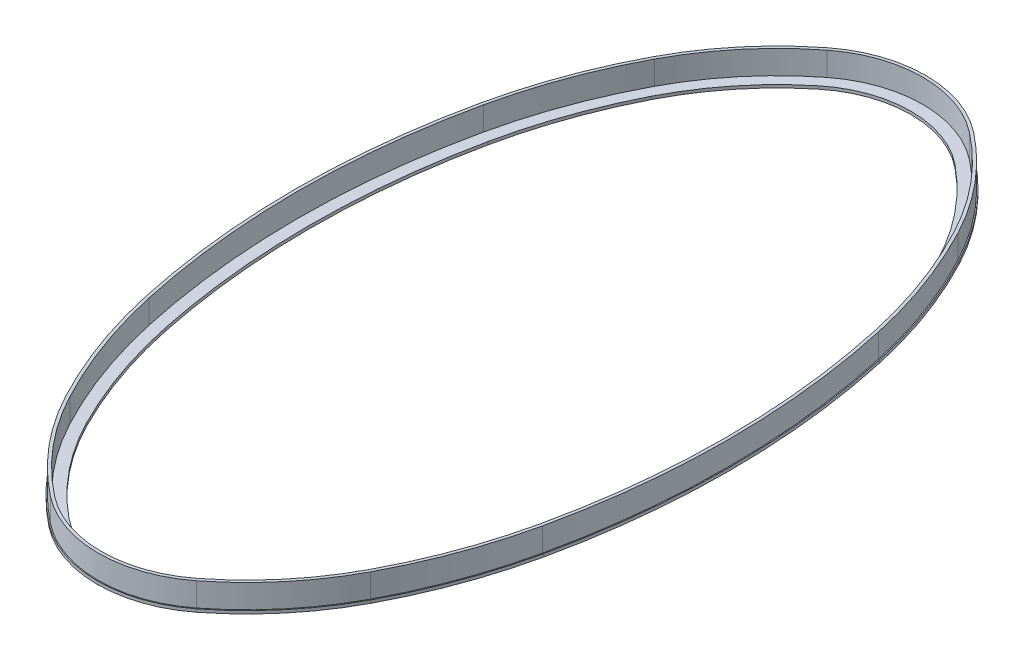
from build123d import *

# Parameters (mm, degrees)
AUFSATZ_LINEAR_AUSTRAGEN1_DEPTH = 3
AUFSATZ_LINEAR_AUSTRAGEN2_DEPTH = 24


with BuildPart() as part:
    # Skizze6 → Aufsatz-Linear austragen1 (new body)
    with BuildSketch(Plane(origin=(0, 0, 0), x_dir=(1, 0, 0), z_dir=(0, 1, 0))):
        with BuildLine():
            ThreePointArc((74.715017555, -984.244606231), (39.514788866, -1003.380457082), (0, -1010))
            ThreePointArc((0, -1010), (-39.514788866, -1003.380457082), (-74.715017555, -984.244606231))
            ThreePointArc((-74.715017555, -984.244606231), (-120.229343231, -940.206746616), (-155.564200335, -887.64882814))
            ThreePointArc((-155.564200335, -887.64882814), (-183.386784686, -825.20269993), (-202.517873317, -759.570264533))
            ThreePointArc((-202.517873317, -759.570264533), (-221.000459131, -589), (-202.517873317, -418.429735467))
            ThreePointArc((-202.517873317, -418.429735467), (-183.386784686, -352.79730007), (-155.564200335, -290.35117186))
            ThreePointArc((-155.564200335, -290.35117186), (-120.229343231, -237.793253384), (-74.715017555, -193.755393769))
            ThreePointArc((-74.715017555, -193.755393769), (0, -168), (74.715017555, -193.755393769))
            ThreePointArc((74.715017555, -193.755393769), (120.22934323, -237.793253384), (155.564200335, -290.35117186))
            ThreePointArc((155.564200335, -290.35117186), (183.386784686, -352.79730007), (202.517873317, -418.429735467))
            ThreePointArc((202.517873317, -418.429735467), (221.000459131, -589), (202.517873317, -759.570264533))
            ThreePointArc((202.517873317, -759.570264533), (183.386784686, -825.20269993), (155.564200335, -887.64882814))
            ThreePointArc((155.564200335, -887.64882814), (120.229343231, -940.206746616), (74.715017555, -984.244606231))
        make_face()
        with BuildLine():
            ThreePointArc((69.633932259, -969.139895548), (0, -994), (-69.633932259, -969.139895548))
            ThreePointArc((-69.633932259, -969.139895548), (-112.193543045, -926.193933206), (-144.95696967, -875.378246381))
            ThreePointArc((-144.95696967, -875.378246381), (-170.511926155, -815.453351782), (-188.023213714, -752.704617917))
            ThreePointArc((-188.023213714, -752.704617917), (-205.000112468, -589), (-188.023213714, -425.295382084))
            ThreePointArc((-188.023213714, -425.295382084), (-170.511926155, -362.546648219), (-144.95696967, -302.621753619))
            ThreePointArc((-144.95696967, -302.621753619), (-112.193543045, -251.806066794), (-69.633932259, -208.860104452))
            ThreePointArc((-69.633932259, -208.860104452), (0, -184), (69.633932259, -208.860104452))
            ThreePointArc((69.633932259, -208.860104452), (112.193543044, -251.806066794), (144.95696967, -302.621753619))
            ThreePointArc((144.95696967, -302.621753619), (170.511926155, -362.546648218), (188.023213714, -425.295382083))
            ThreePointArc((188.023213714, -425.295382083), (205.000112468, -589), (188.023213714, -752.704617917))
            ThreePointArc((188.023213714, -752.704617917), (170.511926155, -815.453351782), (144.95696967, -875.378246381))
            ThreePointArc((144.95696967, -875.378246381), (112.193543044, -926.193933206), (69.633932259, -969.139895548))
        make_face(mode=Mode.SUBTRACT)
    extrude(amount=-AUFSATZ_LINEAR_AUSTRAGEN1_DEPTH)


with BuildPart() as body_2:
    # Skizze7 → Aufsatz-Linear austragen2 (new body)
    with BuildSketch(Plane(origin=(0, 0, 0), x_dir=(1, 0, 0), z_dir=(0, 1, 0))):
        with BuildLine():
            ThreePointArc((74.098810354, -983.45702215), (119.462500767, -939.564911251), (154.680412814, -887.180939674))
            ThreePointArc((154.680412814, -887.180939674), (182.44788831, -824.858499994), (201.541083539, -759.356064322))
            ThreePointArc((201.541083539, -759.356064322), (220.000459131, -589), (201.541083539, -418.643935678))
            ThreePointArc((201.541083539, -418.643935678), (182.44788831, -353.141500006), (154.680412814, -290.819060326))
            ThreePointArc((154.680412814, -290.819060326), (119.462500767, -238.435088749), (74.098810353, -194.54297785))
            ThreePointArc((74.098810353, -194.54297785), (0, -169), (-74.098810353, -194.54297785))
            ThreePointArc((-74.098810353, -194.54297785), (-119.462500767, -238.435088749), (-154.680412814, -290.819060327))
            ThreePointArc((-154.680412814, -290.819060327), (-182.447888311, -353.141500006), (-201.54108354, -418.643935678))
            ThreePointArc((-201.54108354, -418.643935678), (-220.000459131, -589), (-201.54108354, -759.356064322))
            ThreePointArc((-201.54108354, -759.356064322), (-182.447888311, -824.858499994), (-154.680412814, -887.180939674))
            ThreePointArc((-154.680412814, -887.180939674), (-119.462500767, -939.564911251), (-74.098810354, -983.45702215))
            ThreePointArc((-74.098810354, -983.45702215), (0, -1009), (74.098810354, -983.45702215))
        make_face()
        with BuildLine():
            ThreePointArc((72.250188748, -981.094269907), (117.161973376, -937.639405155), (152.029050249, -885.777274275))
            ThreePointArc((152.029050249, -885.777274275), (179.631199184, -823.825900187), (198.610714207, -758.713463688))
            ThreePointArc((198.610714207, -758.713463688), (217.000459131, -589), (198.610714207, -419.286536312))
            ThreePointArc((198.610714207, -419.286536312), (179.631199184, -354.174099814), (152.029050249, -292.222725725))
            ThreePointArc((152.029050249, -292.222725725), (117.161973376, -240.360594845), (72.250188748, -196.905730093))
            ThreePointArc((72.250188748, -196.905730093), (0, -172), (-72.250188748, -196.905730093))
            ThreePointArc((-72.250188748, -196.905730093), (-117.161973376, -240.360594845), (-152.029050249, -292.222725725))
            ThreePointArc((-152.029050249, -292.222725725), (-179.631199184, -354.174099814), (-198.610714207, -419.286536312))
            ThreePointArc((-198.610714207, -419.286536312), (-217.000459131, -589), (-198.610714207, -758.713463688))
            ThreePointArc((-198.610714207, -758.713463688), (-179.631199184, -823.825900187), (-152.029050249, -885.777274275))
            ThreePointArc((-152.029050249, -885.777274275), (-117.161973376, -937.639405155), (-72.250188748, -981.094269907))
            ThreePointArc((-72.250188748, -981.094269907), (0, -1006), (72.250188748, -981.094269907))
        make_face(mode=Mode.SUBTRACT)
    extrude(amount=AUFSATZ_LINEAR_AUSTRAGEN2_DEPTH)


solid = Compound([part.part, body_2.part])
